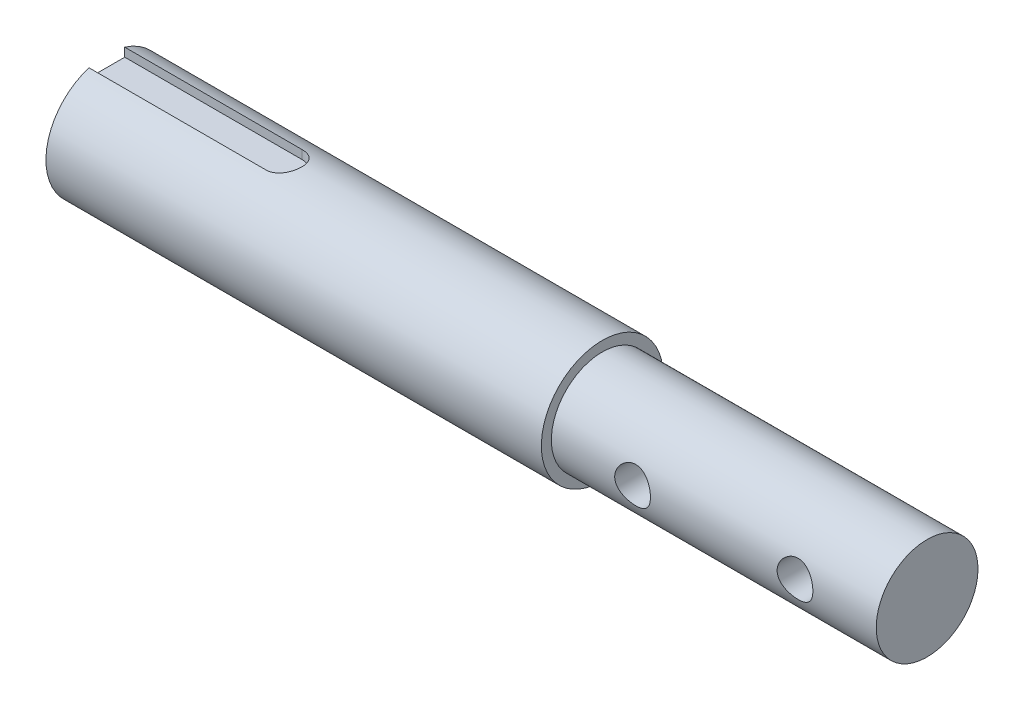
from build123d import *

# Parameters (mm, degrees)
SKETCH1_R               = 37.5
BOSS_EXTRUDE1_DEPTH     = 305
SKETCH2_R               = 31.34
BOSS_EXTRUDE2_DEPTH     = 200
CUT_EXTRUDE1_DEPTH      = 7
CUT_EXTRUDE2_DEPTH      = 508.777018006
CUT_EXTRUDE2_DEPTH_BACK = 508.777018006
SKETCH4_R               = 11


with BuildPart() as part:
    # Sketch1 → Boss-Extrude1 (new body)
    with BuildSketch(Plane(origin=(0, 0, 0), x_dir=(0, 0, -1), z_dir=(1, 0, 0))):
        Circle(SKETCH1_R)
    extrude(amount=BOSS_EXTRUDE1_DEPTH)

    # Sketch2 → Boss-Extrude2 (add)
    with BuildSketch(Plane(origin=(305, 0, 0), x_dir=(0, 0, -1), z_dir=(1, 0, 0))):
        Circle(SKETCH2_R)
    extrude(amount=BOSS_EXTRUDE2_DEPTH)

    # Sketch3 → Cut-Extrude1 (cut)
    with BuildSketch(Plane(origin=(0, 37.5, 0), x_dir=(1, 0, 0), z_dir=(0, 1, 0))):
        with BuildLine():
            Line((109, -11), (0, -11))
            Line((0, -11), (0, 11))
            Line((0, 11), (109, 11))
            ThreePointArc((109, 11), (120, 0), (109, -11))
        make_face()
    extrude(amount=-CUT_EXTRUDE1_DEPTH, mode=Mode.SUBTRACT)

    # Sketch4 → Cut-Extrude2 (cut, two sides: drawn at the far end of the back side and taken through both)
    with BuildSketch(Plane.XY.offset(-CUT_EXTRUDE2_DEPTH_BACK)):
        with Locations((355, 0)):
            Circle(SKETCH4_R)
        with Locations((455, 0)):
            Circle(SKETCH4_R)
    extrude(amount=CUT_EXTRUDE2_DEPTH + CUT_EXTRUDE2_DEPTH_BACK, mode=Mode.SUBTRACT)


solid = part.part
